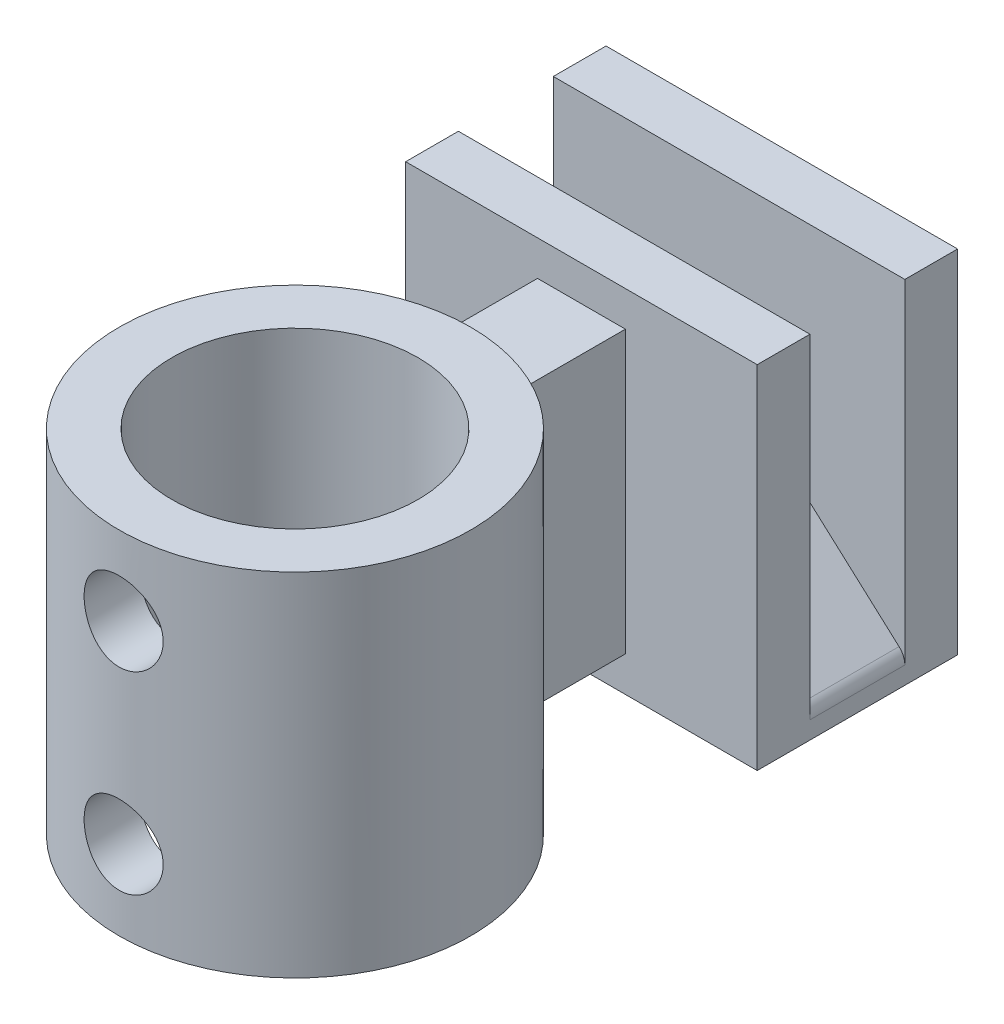
from build123d import *

# Parameters (mm, degrees)
SKETCH2_W                       = 20
SKETCH2_H                       = 10
BOSS_EXTRUDE1_DEPTH             = 2.7
CHAMFER1_SIZE                   = 9.5
CHAMFER1_SIZE2                  = 8.553838421
FILLET3_R                       = 1
SKETCH3_W                       = 20
SKETCH3_H                       = 20
BOSS_EXTRUDE2_DEPTH             = 3
BOSS_EXTRUDE3_REACH             = 20.907
SKETCH6_R                       = 10
SKETCH6_R_2                     = 7
BOSS_EXTRUDE3_DIRECTION_2_REACH = 20.907
BOSS_EXTRUDE4_REACH             = 33.886
BOSS_EXTRUDE4_END_RADIUS        = 10
SKETCH5_W                       = 5
SKETCH5_H                       = 16
CUT_EXTRUDE1_REACH              = 33.393
CUT_EXTRUDE1_END_RADIUS         = 10
SKETCH7_R                       = 2.25


with BuildPart() as part:
    # Sketch2 → Boss-Extrude1 (new, symmetric)
    with BuildSketch(Plane.XY):
        Rectangle(SKETCH2_W, SKETCH2_H)
    extrude(amount=BOSS_EXTRUDE1_DEPTH, both=True)

    # Chamfer1
    chamfer1_edges = [part.edges().sort_by_distance(p)[0] for p in [
        (-10, 5, 0),
        (10, 5, 0),
    ]]
    chamfer1_side = [part.faces().sort_by_distance(p)[0] for p in [
        (0, 5, 0),
    ]]
    chamfer(chamfer1_edges, length=CHAMFER1_SIZE, length2=CHAMFER1_SIZE2, reference=chamfer1_side[0])

    # Fillet3
    fillet3_edges = [part.edges().sort_by_distance(p)[0] for p in [
        (-0.5, 5, 0),
        (0.5, 5, 0),
        (10, -3.553838421, 0),
        (-10, -3.553838421, 0),
    ]]
    fillet(fillet3_edges, radius=FILLET3_R)

    # Sketch3 → Boss-Extrude2 (add)
    with BuildSketch(Plane.XY.offset(2.7)):
        with Locations((0, 5)):
            Rectangle(SKETCH3_W, SKETCH3_H)
    boss_extrude2 = extrude(amount=BOSS_EXTRUDE2_DEPTH)

    # Mirror1: Boss-Extrude2 across plane
    add(boss_extrude2.mirror(Plane.XY))


with BuildPart() as body_2:

    # Boss-Extrude3: up to this face of the body (flat: up to its plane)
    boss_extrude3_end = Plane(part.part.faces().sort_by_distance((0, 15, 4.2))[0])
    # Sketch6 → Boss-Extrude3 (new, up to the picked face)
    with BuildSketch(Plane(origin=(0, 0, 0), x_dir=(1, 0, 0), z_dir=(0, 1, 0)), mode=Mode.PRIVATE) as boss_extrude3_sk1:
        with Locations(Location((0, -22, 0), (0, 0, 90))):
            Circle(SKETCH6_R)
        with Locations(Location((0, -22, 0), (0, 0, 90))):
            Circle(SKETCH6_R_2, mode=Mode.SUBTRACT)
    boss_extrude3_tool1 = split(extrude(boss_extrude3_sk1.sketch, amount=BOSS_EXTRUDE3_REACH, mode=Mode.PRIVATE), bisect_by=boss_extrude3_end, keep=Keep.BOTH, mode=Mode.PRIVATE)
    add(boss_extrude3_tool1.solids().sort_by(Axis((0, 0, 31.717157), (0, 1, 0)))[0])


    # Boss-Extrude3 direction 2: up to this face of the body (flat: up to its plane)
    boss_extrude3_direction_2_end = Plane(part.part.faces().sort_by_distance((0, -5, 0))[0])
    # Sketch6 → Boss-Extrude3 direction 2 (add, up to the picked face)
    with BuildSketch(Plane(origin=(0, 0, 0), x_dir=(1, 0, 0), z_dir=(0, 1, 0)), mode=Mode.PRIVATE) as boss_extrude3_direction_2_sk1:
        with Locations(Location((0, -22, 0), (0, 0, 90))):
            Circle(SKETCH6_R)
        with Locations(Location((0, -22, 0), (0, 0, 90))):
            Circle(SKETCH6_R_2, mode=Mode.SUBTRACT)
    boss_extrude3_direction_2_tool1 = split(extrude(boss_extrude3_direction_2_sk1.sketch, amount=-BOSS_EXTRUDE3_DIRECTION_2_REACH, mode=Mode.PRIVATE), bisect_by=boss_extrude3_direction_2_end, keep=Keep.BOTH, mode=Mode.PRIVATE)
    add(boss_extrude3_direction_2_tool1.solids().sort_by(Axis((0, 0, 31.717157), (0, -1, 0)))[0])


with BuildPart() as part_1:
    add(part.part)

    add(body_2.part)  # Boss-Extrude4 merges body 2
    # Boss-Extrude4: up to this cylinder (the profile starts outside it)
    boss_extrude4_end = Plane(origin=(0, 5, 22), z_dir=(0, -1, 0)) * Cylinder(BOSS_EXTRUDE4_END_RADIUS, 88.772, mode=Mode.PRIVATE)
    # Sketch5 → Boss-Extrude4 (add, up to the surface)
    with BuildSketch(Plane.XY.offset(5.7), mode=Mode.PRIVATE) as boss_extrude4_sk1:
        with Locations((0, 5)):
            Rectangle(SKETCH5_W, SKETCH5_H)
    boss_extrude4_tool1 = extrude(boss_extrude4_sk1.sketch, amount=BOSS_EXTRUDE4_REACH, mode=Mode.PRIVATE) - boss_extrude4_end
    add(boss_extrude4_tool1.solids().sort_by_distance((0, 5, 5.7))[0])

    # Cut-Extrude1: up to this cylinder (the profile starts inside it)
    cut_extrude1_end = Plane(origin=(0, 5, 22), z_dir=(0, -1, 0)) * Cylinder(CUT_EXTRUDE1_END_RADIUS, 98.786, mode=Mode.PRIVATE)
    # Sketch7 → Cut-Extrude1 (cut, up to the surface)
    with BuildSketch(Plane.XY.offset(20), mode=Mode.PRIVATE) as cut_extrude1_sk1:
        with Locations(Location((0, 10.5, 0), (0, 0, 180))):
            Circle(SKETCH7_R)
    cut_extrude1_tool1 = extrude(cut_extrude1_sk1.sketch, amount=CUT_EXTRUDE1_REACH, mode=Mode.PRIVATE) & cut_extrude1_end
    add(cut_extrude1_tool1.solids().sort_by_distance((0, 10.5, 20))[0], mode=Mode.SUBTRACT)
    # Sketch7 → Cut-Extrude1 (cut, up to the surface)
    with BuildSketch(Plane.XY.offset(20), mode=Mode.PRIVATE) as cut_extrude1_sk2:
        with Locations(Location((0, -0.5, 0), (0, 0, 180))):
            Circle(SKETCH7_R)
    cut_extrude1_tool2 = extrude(cut_extrude1_sk2.sketch, amount=CUT_EXTRUDE1_REACH, mode=Mode.PRIVATE) & cut_extrude1_end
    add(cut_extrude1_tool2.solids().sort_by_distance((0, -0.5, 20))[0], mode=Mode.SUBTRACT)


solid = part_1.part
